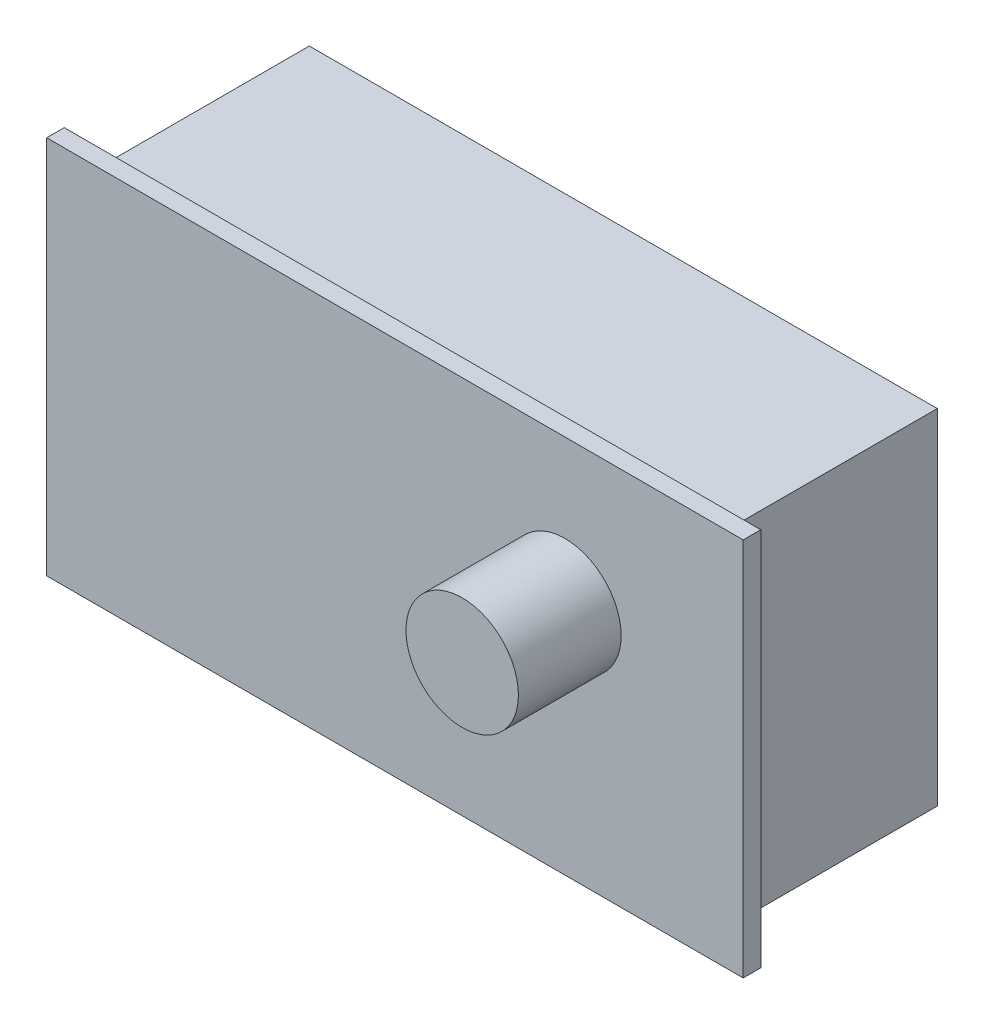
from build123d import *

# Parameters (mm, degrees)
ESQUISSE1_W        = 71.5
ESQUISSE1_H        = 39.2
BOSS_EXTRU_1_DEPTH = 24
ESQUISSE2_W        = 79.3
ESQUISSE2_H        = 43.2
BOSS_EXTRU_2_DEPTH = 2
ESQUISSE3_R        = 6.4
BOSS_EXTRU_3_DEPTH = 11.7


with BuildPart() as part:
    # Esquisse1 → Boss.-Extru.1 (new body)
    with BuildSketch(Plane.XY):
        with Locations((35.75, -19.6)):
            Rectangle(ESQUISSE1_W, ESQUISSE1_H)
    extrude(amount=BOSS_EXTRU_1_DEPTH)

    # Esquisse2 → Boss.-Extru.2 (add)
    with BuildSketch(Plane.XY.offset(24)):
        with Locations((35.75, -19.6)):
            Rectangle(ESQUISSE2_W, ESQUISSE2_H)
    extrude(amount=BOSS_EXTRU_2_DEPTH)

    # Esquisse3 → Boss.-Extru.3 (add)
    with BuildSketch(Plane.XY.offset(26)):
        with Locations((55.105708791, -14.4)):
            Circle(ESQUISSE3_R)
    extrude(amount=BOSS_EXTRU_3_DEPTH)


solid = part.part
